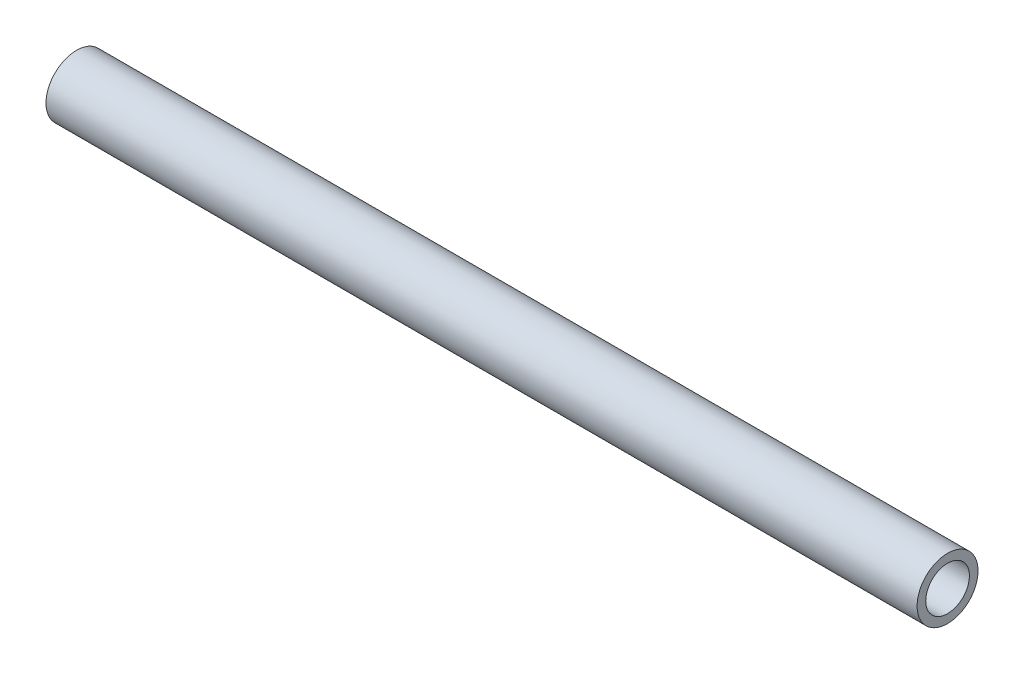
from build123d import *

# Parameters (mm, degrees)
SKETCH1_R           = 10.668
SKETCH1_R_2         = 7.6454
BOSS_EXTRUDE1_DEPTH = 304.8


with BuildPart() as part:
    # Sketch1 → Boss-Extrude1 (new body)
    with BuildSketch(Plane(origin=(0, 0, 0), x_dir=(0, 0, -1), z_dir=(1, 0, 0))):
        with Locations(Location((0, 0, 0), (0, 0, 180))):
            Circle(SKETCH1_R)
        with Locations(Location((0, 0, 0), (0, 0, 180))):
            Circle(SKETCH1_R_2, mode=Mode.SUBTRACT)
    extrude(amount=BOSS_EXTRUDE1_DEPTH)


solid = part.part
